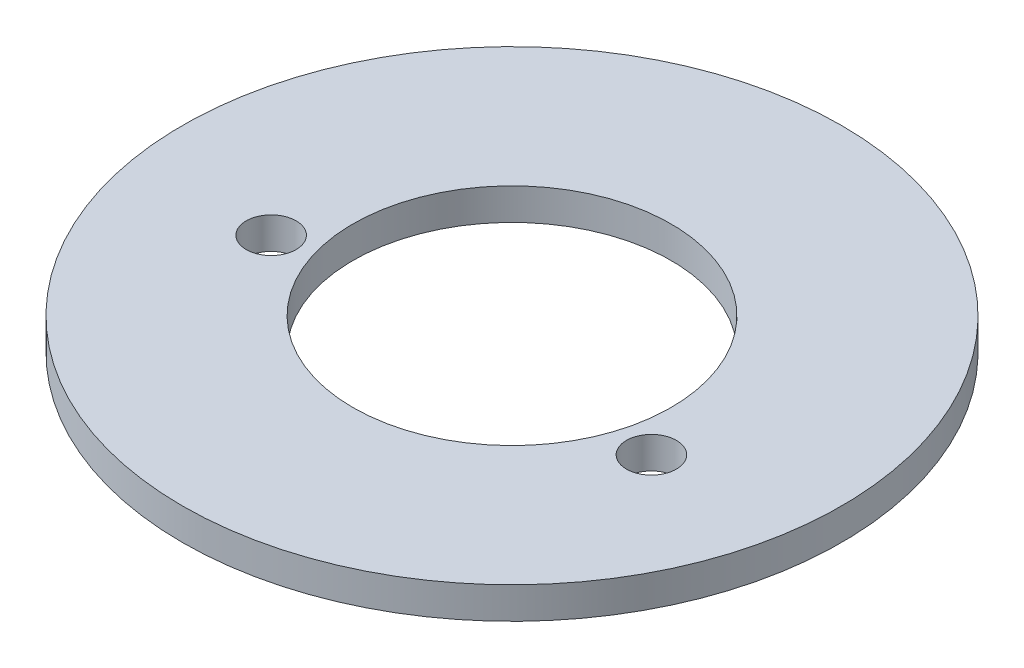
from build123d import *

# Parameters (mm, degrees)
SKETCH1_R           = 66.04
BOSS_EXTRUDE1_DEPTH = 6.35
SKETCH2_R           = 31.877
CUT_EXTRUDE1_DEPTH  = 6.35
SKETCH3_R           = 5
CUT_EXTRUDE2_DEPTH  = 6.35


with BuildPart() as part:
    # Sketch1 → Boss-Extrude1 (new body)
    with BuildSketch(Plane(origin=(0, 0, 0), x_dir=(1, 0, 0), z_dir=(0, 1, 0))):
        with Locations(Location((0, 0, 0), (0, 0, 270))):
            Circle(SKETCH1_R)
    extrude(amount=BOSS_EXTRUDE1_DEPTH)

    # Sketch2 → Cut-Extrude1 (cut)
    with BuildSketch(Plane(origin=(0, 6.35, 0), x_dir=(1, 0, 0), z_dir=(0, 1, 0))):
        with Locations(Location((0, 0, 0), (0, 0, 270))):
            Circle(SKETCH2_R)
    extrude(amount=-CUT_EXTRUDE1_DEPTH, mode=Mode.SUBTRACT)

    # Sketch3 → Cut-Extrude2 (cut)
    with BuildSketch(Plane(origin=(0, 6.35, 0), x_dir=(1, 0, 0), z_dir=(0, 1, 0))):
        with Locations(Location((38.1, -10.16, 0), (0, 0, 270))):
            Circle(SKETCH3_R)
        with Locations(Location((-38.1, -10.16, 0), (0, 0, 270))):
            Circle(SKETCH3_R)
    extrude(amount=-CUT_EXTRUDE2_DEPTH, mode=Mode.SUBTRACT)


solid = part.part
